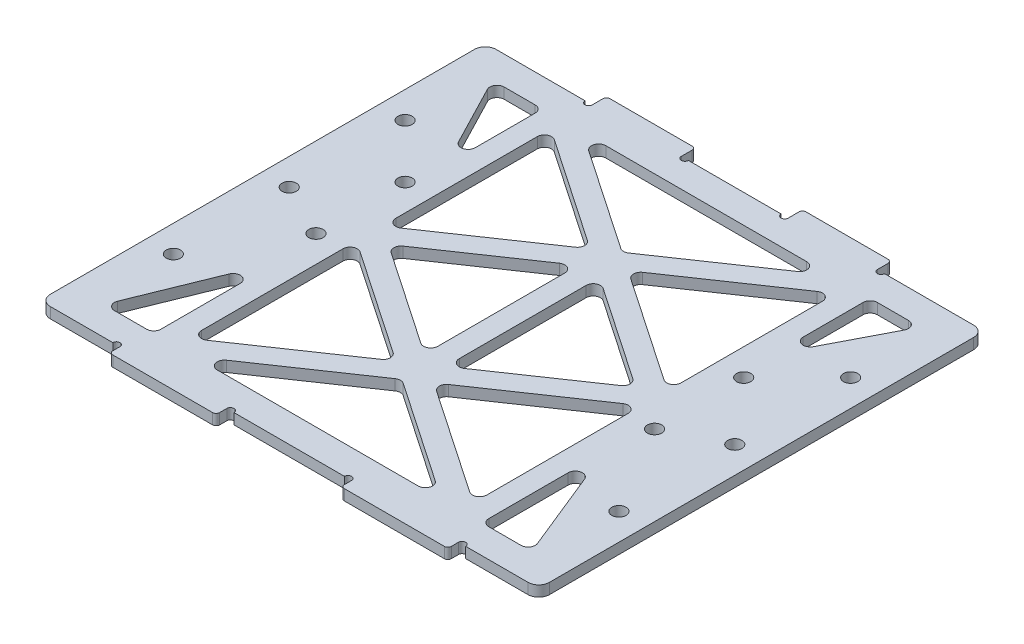
from build123d import *

# Parameters (mm, degrees)
SKETCH_1_R          = 2
EXTRUDE_1_DEPTH     = 3
SKETCH_3_W          = 80
SKETCH_3_H          = 109
CUT_EXTRUDE_2_DEPTH = 147.799182559
SKETCH_2_R          = 1
CUT_EXTRUDE_1_DEPTH = 147.799182559
SKETCH_5_W          = 6
SKETCH_5_H          = 54.5
EXTRUDE_1_2_DEPTH   = 3
FILLET_1_R          = 2
FILLET_2_R          = 1
FILLET_3_R          = 3


with BuildPart() as part:
    # 草图1 → Extrude 1 (new body)
    with BuildSketch(Plane(origin=(0, 0, 0), x_dir=(1, 0, 0), z_dir=(0, 1, 0))):
        Polygon((-17.5, 0), (17.5, 0), (17.5, -3), (47.5, -3), (47.5, 0), (70, 0), (70, 125), (40, 125), (40, 129), (15, 129), (15, 125), (-15, 125), (-15, 129), (-40, 129), (-40, 125), (-70, 125), (-70, 0), (-47.5, 0), (-47.5, -3), (-17.5, -3), align=None)
        with Locations(Location((47.5, 80, 0), (0, 0, 270))):
            Circle(SKETCH_1_R, mode=Mode.SUBTRACT)
        with Locations(Location((47.5, 55, 0), (0, 0, 270))):
            Circle(SKETCH_1_R, mode=Mode.SUBTRACT)
        with Locations(Location((-47.5, 55, 0), (0, 0, 90))):
            Circle(SKETCH_1_R, mode=Mode.SUBTRACT)
        with Locations(Location((-47.5, 80, 0), (0, 0, 90))):
            Circle(SKETCH_1_R, mode=Mode.SUBTRACT)
        with Locations(Location((-62.5, 30, 0), (0, 0, 270))):
            Circle(SKETCH_1_R, mode=Mode.SUBTRACT)
        with Locations(Location((-62.5, 62.5, 0), (0, 0, 270))):
            Circle(SKETCH_1_R, mode=Mode.SUBTRACT)
        with Locations(Location((-62.5, 95, 0), (0, 0, 270))):
            Circle(SKETCH_1_R, mode=Mode.SUBTRACT)
        with Locations(Location((62.5, 95, 0), (0, 0, 90))):
            Circle(SKETCH_1_R, mode=Mode.SUBTRACT)
        with Locations(Location((62.5, 62.5, 0), (0, 0, 90))):
            Circle(SKETCH_1_R, mode=Mode.SUBTRACT)
        with Locations(Location((62.5, 30, 0), (0, 0, 90))):
            Circle(SKETCH_1_R, mode=Mode.SUBTRACT)
    extrude(amount=EXTRUDE_1_DEPTH)

    # 草图3 → 切除-拉伸2 (cut, through all)
    with BuildSketch(Plane(origin=(0, 3, 0), x_dir=(1, 0, 0), z_dir=(0, 1, 0))):
        Polygon((-60, 117), (-46, 90), (-46, 117), align=None)
        Polygon((46, 8), (46, 42.5), (60, 8), align=None)
        with Locations((0, 62.5)):
            Rectangle(SKETCH_3_W, SKETCH_3_H)
        Polygon((-46, 42.5), (-60, 8), (-46, 8), align=None)
        Polygon((46, 117), (60, 117), (46, 90), align=None)
    extrude(amount=-CUT_EXTRUDE_2_DEPTH, mode=Mode.SUBTRACT)

    # 草图2 → 切除-拉伸1 (cut, through all)
    with BuildSketch(Plane(origin=(0, 3, 0), x_dir=(1, 0, 0), z_dir=(0, 1, 0))):
        with Locations((-48.5, 0)):
            Circle(SKETCH_2_R)
        with Locations((-16.5, 0)):
            Circle(SKETCH_2_R)
        with Locations((16.5, 0)):
            Circle(SKETCH_2_R)
        with Locations((14, 125)):
            Circle(SKETCH_2_R)
        with Locations((-41, 125)):
            Circle(SKETCH_2_R)
        with Locations((-14, 125)):
            Circle(SKETCH_2_R)
        with Locations((41, 125)):
            Circle(SKETCH_2_R)
        with Locations((48.5, 0)):
            Circle(SKETCH_2_R)
    extrude(amount=-CUT_EXTRUDE_1_DEPTH, mode=Mode.SUBTRACT)

    # 草图5 → Extrude 1 2 (add)
    with BuildSketch(Plane(origin=(0, 3, 0), x_dir=(1, 0, 0), z_dir=(0, 1, 0))):
        Polygon((-41.689048685, 114.52066248), (34.67155679, 62.5), (-41.689048685, 10.47933752), (-38.310951315, 5.52066248), (45.32844321, 62.5), (-38.310951315, 119.47933752), align=None)
        Polygon((41.689048685, 10.47933752), (-34.67155679, 62.5), (41.689048685, 114.52066248), (38.310951315, 119.47933752), (-45.32844321, 62.5), (38.310951315, 5.52066248), align=None)
        with Locations((0, 62.5)):
            Rectangle(SKETCH_5_W, SKETCH_5_H)
    extrude(amount=-EXTRUDE_1_2_DEPTH)

    # 圆角1
    fillet_1_edges = [part.edges().sort_by_distance(p)[0] for p in [
        (46, 1.5, -90),
        (46, 1.5, -117),
        (60, 1.5, -117),
        (60, 1.5, -8),
        (46, 1.5, -8),
        (46, 1.5, -42.5),
        (-46, 1.5, -42.5),
        (-46, 1.5, -8),
        (-60, 1.5, -8),
        (-60, 1.5, -117),
        (-46, 1.5, -117),
        (-46, 1.5, -90),
        (34.67155679, 1.5, -8),
        (-34.67155679, 1.5, -8),
        (40, 1.5, -11.630001937),
        (40, 1.5, -113.369998063),
        (40, 1.5, -66.130001937),
        (40, 1.5, -58.869998063),
        (34.67155679, 1.5, -117),
        (-34.67155679, 1.5, -117),
        (-40, 1.5, -11.630001937),
        (-40, 1.5, -113.369998063),
        (-40, 1.5, -58.869998063),
        (-40, 1.5, -66.130001937),
        (-5.32844321, 1.5, -89.75),
        (-5.32844321, 1.5, -35.25),
        (0, 1.5, -93.380001937),
        (5.32844321, 1.5, -35.25),
        (5.32844321, 1.5, -89.75),
        (0, 1.5, -31.619998063),
        (3, 1.5, -84.076248063),
        (34.67155679, 1.5, -62.5),
        (3, 1.5, -40.923751937),
        (-34.67155679, 1.5, -62.5),
        (-3, 1.5, -40.923751937),
        (-3, 1.5, -84.076248063),
    ]]
    fillet(fillet_1_edges, radius=FILLET_1_R)

    # 圆角2
    fillet_2_edges = [part.edges().sort_by_distance(p)[0] for p in [
        (47.5, 1.5, 3),
        (17.5, 1.5, 3),
        (-17.5, 1.5, 3),
        (-47.5, 1.5, 3),
        (-40, 1.5, -129),
        (-15, 1.5, -129),
        (15, 1.5, -129),
        (40, 1.5, -129),
    ]]
    fillet(fillet_2_edges, radius=FILLET_2_R)

    # 圆角3
    fillet_3_edges = [part.edges().sort_by_distance(p)[0] for p in [
        (70, 1.5, -125),
        (70, 1.5, 0),
        (-70, 1.5, 0),
        (-70, 1.5, -125),
    ]]
    fillet(fillet_3_edges, radius=FILLET_3_R)


solid = part.part
